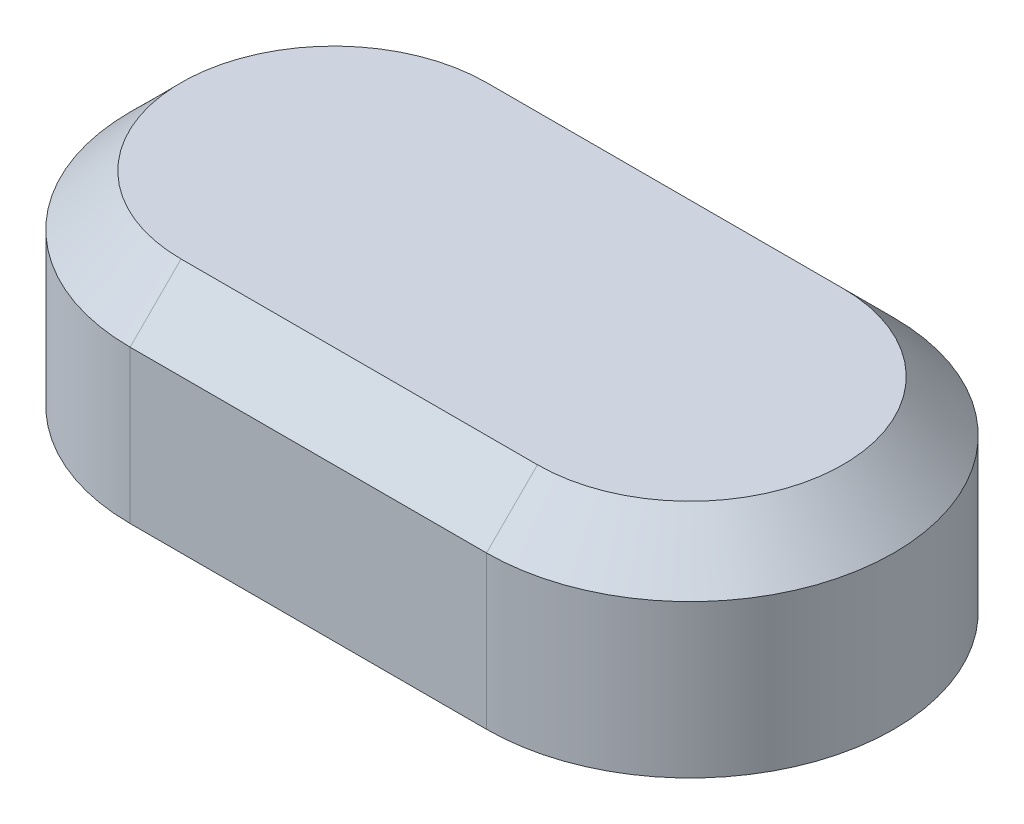
from build123d import *

# Parameters (mm, degrees)
BOSS_EXTRU_1_DEPTH = 4
CHANFREIN1_SIZE    = 1


with BuildPart() as part:
    # Esquisse1 → Boss.-Extru.1 (new body)
    with BuildSketch(Plane(origin=(0, 0, 0), x_dir=(1, 0, 0), z_dir=(0, 1, 0))):
        with BuildLine():
            Line((-3.5, 4), (3.5, 4))
            ThreePointArc((3.5, 4), (7.5, 0), (3.5, -4))
            Line((3.5, -4), (-3.5, -4))
            ThreePointArc((-3.5, -4), (-7.5, 0), (-3.5, 4))
        make_face()
    extrude(amount=BOSS_EXTRU_1_DEPTH)

    # Chanfrein1
    chanfrein1_edges = [part.edges().sort_by_distance(p)[0] for p in [
        (7.5, 4, 0),
        (0, 4, -4),
        (-7.5, 4, 0),
        (0, 4, 4),
    ]]
    chamfer(chanfrein1_edges, length=CHANFREIN1_SIZE)


solid = part.part
